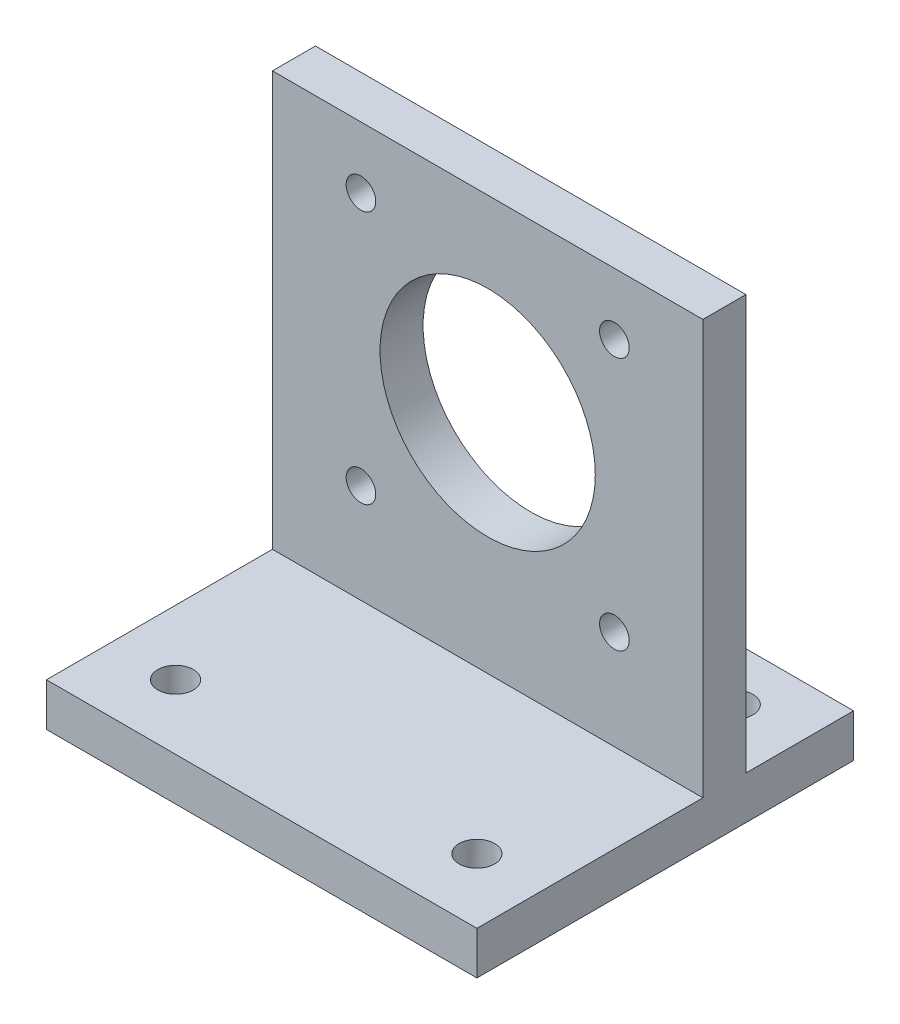
from build123d import *

# Parameters (mm, degrees)
SKETCH1_W                          = 80
SKETCH1_H                          = 85
SKETCH1_R                          = 20
SKETCH1_R_2                        = 2.75
FRONT_PLATE_DEPTH                  = 8
BENCH_FOOT_START                   = -20
SKETCH2_W                          = 80
SKETCH2_H                          = 8
BENCH_FOOT_DEPTH                   = 70
FOUR_M6_FOOT_CLEARANCES_DEPTH      = 82.240384046
FOUR_M6_FOOT_CLEARANCES_DEPTH_BACK = 82.240384046
SKETCH3_R                          = 3.3


with BuildPart() as part:
    # Sketch1 → Front_Plate (new body)
    with BuildSketch(Plane.XY):
        with Locations((0, -7.5)):
            Rectangle(SKETCH1_W, SKETCH1_H)
        Circle(SKETCH1_R, mode=Mode.SUBTRACT)
        with Locations((-23.55, -23.55)):
            Circle(SKETCH1_R_2, mode=Mode.SUBTRACT)
        with Locations((-23.55, 23.55)):
            Circle(SKETCH1_R_2, mode=Mode.SUBTRACT)
        with Locations((23.55, -23.55)):
            Circle(SKETCH1_R_2, mode=Mode.SUBTRACT)
        with Locations((23.55, 23.55)):
            Circle(SKETCH1_R_2, mode=Mode.SUBTRACT)
    extrude(amount=FRONT_PLATE_DEPTH)

    # Sketch2 → Bench_Foot (add)
    with BuildSketch(Plane.XY.offset(BENCH_FOOT_START)):
        with Locations((0, -46)):
            Rectangle(SKETCH2_W, SKETCH2_H)
    extrude(amount=BENCH_FOOT_DEPTH)

    # Sketch3 → Four_M6_Foot_Clearances (cut, two sides: drawn at the far end of the back side and taken through both)
    with BuildSketch(Plane(origin=(0, 0, 0), x_dir=(1, 0, 0), z_dir=(0, 1, 0)).offset(-FOUR_M6_FOOT_CLEARANCES_DEPTH_BACK)):
        with Locations(Location((-28, 10, 0), (0, 0, 270))):
            Circle(SKETCH3_R)
        with Locations(Location((-28, -38, 0), (0, 0, 270))):
            Circle(SKETCH3_R)
        with Locations(Location((28, 10, 0), (0, 0, 270))):
            Circle(SKETCH3_R)
        with Locations(Location((28, -38, 0), (0, 0, 270))):
            Circle(SKETCH3_R)
    extrude(amount=FOUR_M6_FOOT_CLEARANCES_DEPTH + FOUR_M6_FOOT_CLEARANCES_DEPTH_BACK, mode=Mode.SUBTRACT)


solid = part.part
